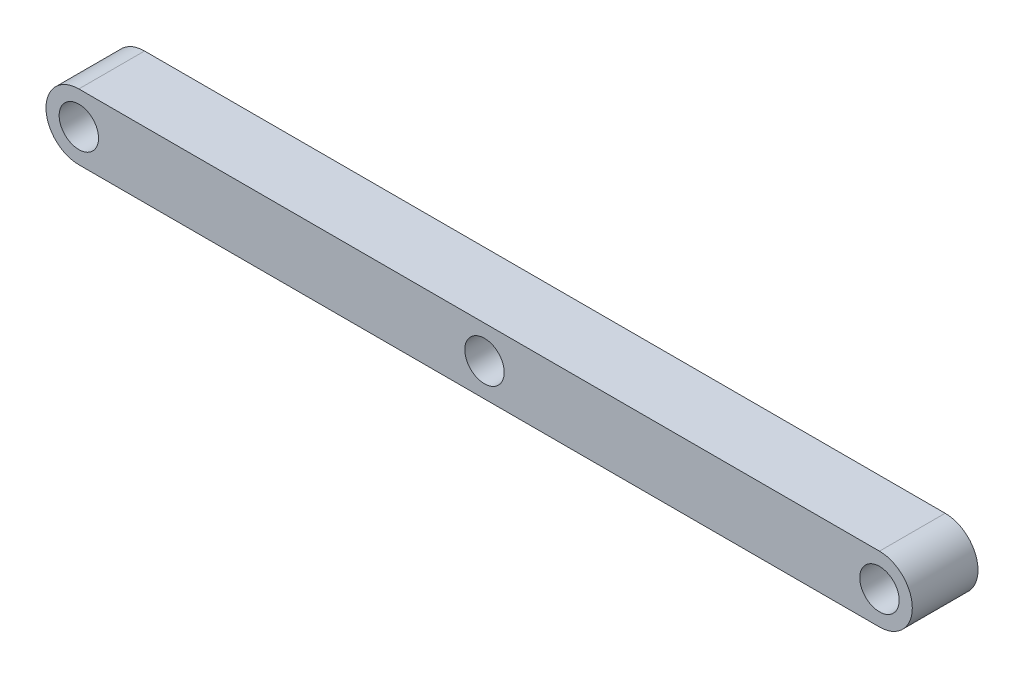
from build123d import *

# Parameters (mm, degrees)
SKETCH1_R           = 1.5
BOSS_EXTRUDE1_DEPTH = 2.5


with BuildPart() as part:
    # Sketch1 → Boss-Extrude1 (new, symmetric)
    with BuildSketch(Plane.XY):
        with BuildLine():
            Line((-30.46875, 2.5), (30.46875, 2.5))
            ThreePointArc((30.46875, 2.5), (32.96875, 0), (30.46875, -2.5))
            Line((30.46875, -2.5), (-30.46875, -2.5))
            ThreePointArc((-30.46875, -2.5), (-32.96875, 0), (-30.46875, 2.5))
        make_face()
        with Locations((-30.46875, 0)):
            Circle(SKETCH1_R, mode=Mode.SUBTRACT)
        with Locations((30.46875, 0)):
            Circle(SKETCH1_R, mode=Mode.SUBTRACT)
        with Locations((0.40625, 0)):
            Circle(SKETCH1_R, mode=Mode.SUBTRACT)
    extrude(amount=BOSS_EXTRUDE1_DEPTH, both=True)


solid = part.part
